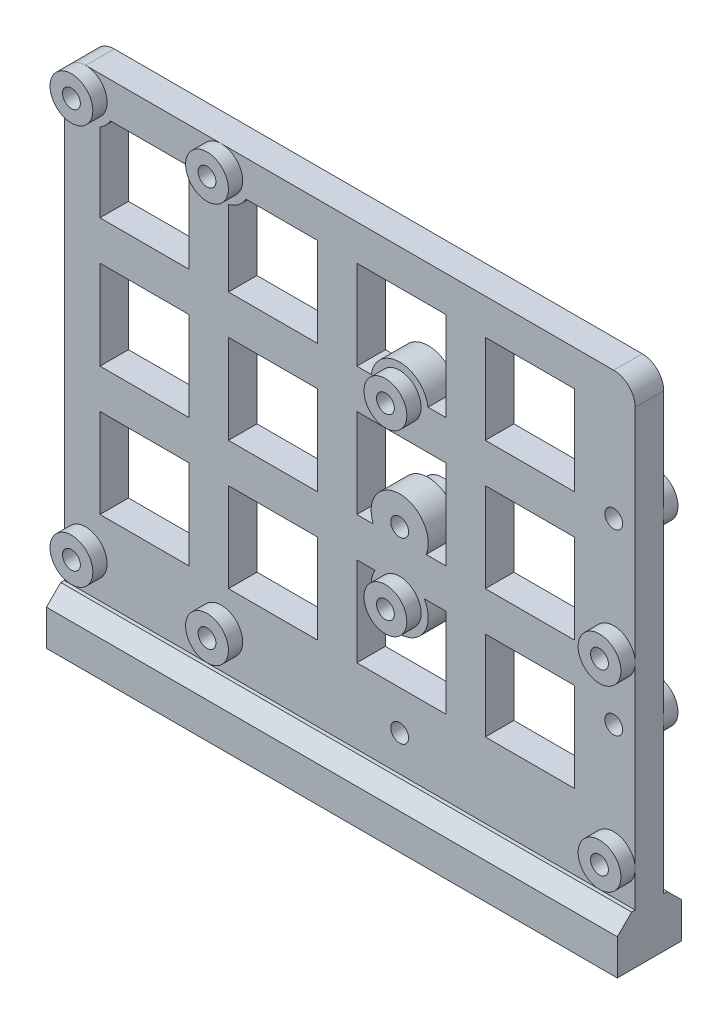
from build123d import *

# Parameters (mm, degrees)
SKETCH1_W           = 25
SKETCH1_H           = 62
SKETCH1_W_2         = 55
BOSS_EXTRUDE1_DEPTH = 4
SKETCH2_R           = 1.25
CUT_EXTRUDE1_DEPTH  = 4
BOSS_EXTRUDE2_START = 2
SKETCH3_R           = 3
SKETCH3_R_2         = 1.25
BOSS_EXTRUDE2_DEPTH = 2
SKETCH4_R           = 1.25
CUT_EXTRUDE2_DEPTH  = 10
BOSS_EXTRUDE3_START = 2
SKETCH5_R           = 3
SKETCH5_R_2         = 1.25
BOSS_EXTRUDE3_DEPTH = 2
LPATTERN1_COUNT     = 2
LPATTERN1_PITCH     = 25
SKETCH6_R           = 1.25
CUT_EXTRUDE3_DEPTH  = 75.520131508
BOSS_EXTRUDE4_START = 2
SKETCH7_R           = 3
SKETCH7_R_2         = 1.25
BOSS_EXTRUDE4_DEPTH = 2
SKETCH8_W           = 12.5
SKETCH8_H           = 12.5
CUT_EXTRUDE4_DEPTH  = 75.520131508
FILLET1_R           = 3
BOSS_EXTRUDE5_DEPTH = 2
SKETCH10_W          = 80
SKETCH10_H          = 9
BOSS_EXTRUDE6_DEPTH = 7
CHAMFER1_SIZE       = 2
SKETCH11_R          = 1.45
CUT_EXTRUDE5_DEPTH  = 7


with BuildPart() as part:
    # Sketch1 → Boss-Extrude1 (new body)
    with BuildSketch(Plane.XY):
        Rectangle(SKETCH1_W, SKETCH1_H)
        with Locations((40, 0)):
            Rectangle(SKETCH1_W_2, SKETCH1_H)
    extrude(amount=BOSS_EXTRUDE1_DEPTH)

    # Sketch2 → Cut-Extrude1 (cut)
    with BuildSketch(Plane.XY.offset(4)):
        with Locations((-9.5, -28)):
            Circle(SKETCH2_R)
        with Locations(Location((9.5, -28, 0), (0, 0, 180))):
            Circle(SKETCH2_R)
        with Locations((9.5, 28)):
            Circle(SKETCH2_R)
        with Locations(Location((-9.5, 28, 0), (0, 0, 180))):
            Circle(SKETCH2_R)
    extrude(amount=-CUT_EXTRUDE1_DEPTH, mode=Mode.SUBTRACT)

    # Sketch3 → Boss-Extrude2 (add)
    # profile 1 of 4: a face of its own
    with BuildSketch(Plane.XY.offset(4).offset(BOSS_EXTRUDE2_START)):
        with Locations(Location((-9.5, 28, 0), (0, 0, 180))):
            Circle(SKETCH3_R)
        with Locations((-9.5, 28)):
            Circle(SKETCH3_R_2, mode=Mode.SUBTRACT)
    # profile 2 of 4: a face of its own
    with BuildSketch(Plane.XY.offset(4).offset(BOSS_EXTRUDE2_START)):
        with Locations(Location((9.5, 28, 0), (0, 0, 90))):
            Circle(SKETCH3_R)
        with Locations((9.5, 28)):
            Circle(SKETCH3_R_2, mode=Mode.SUBTRACT)
    # profile 3 of 4: a face of its own
    with BuildSketch(Plane.XY.offset(4).offset(BOSS_EXTRUDE2_START)):
        with Locations(Location((-9.5, -28, 0), (0, 0, 180))):
            Circle(SKETCH3_R)
        with Locations((-9.5, -28)):
            Circle(SKETCH3_R_2, mode=Mode.SUBTRACT)
    # profile 4 of 4: a face of its own
    with BuildSketch(Plane.XY.offset(4).offset(BOSS_EXTRUDE2_START)):
        with Locations(Location((9.5, -28, 0), (0, 0, 270))):
            Circle(SKETCH3_R)
        with Locations((9.5, -28)):
            Circle(SKETCH3_R_2, mode=Mode.SUBTRACT)
    extrude(amount=-BOSS_EXTRUDE2_DEPTH)

    # Sketch4 → Cut-Extrude2 (cut)
    with BuildSketch(Plane.XY.offset(4)):
        with Locations((34.5, -12)):
            Circle(SKETCH4_R)
        with Locations((64.5, -28)):
            Circle(SKETCH4_R)
    cut_extrude2 = extrude(amount=-CUT_EXTRUDE2_DEPTH, mode=Mode.SUBTRACT)

    # Sketch5 → Boss-Extrude3 (add)
    # profile 1 of 2: a face of its own
    with BuildSketch(Plane.XY.offset(4).offset(BOSS_EXTRUDE3_START)):
        with Locations((34.5, -12)):
            Circle(SKETCH5_R)
        with Locations((34.5, -12)):
            Circle(SKETCH5_R_2, mode=Mode.SUBTRACT)
    # profile 2 of 2: a face of its own
    with BuildSketch(Plane.XY.offset(4).offset(BOSS_EXTRUDE3_START)):
        with Locations((64.5, -28)):
            Circle(SKETCH5_R)
        with Locations((64.5, -28)):
            Circle(SKETCH5_R_2, mode=Mode.SUBTRACT)
    boss_extrude3 = extrude(amount=-BOSS_EXTRUDE3_DEPTH)

    # LPattern1: Cut-Extrude2, Boss-Extrude3 ×2
    with Locations(*[(0, i * LPATTERN1_PITCH, 0) for i in range(1, LPATTERN1_COUNT)]):
        add(cut_extrude2, mode=Mode.SUBTRACT)
        add(boss_extrude3)

    # Sketch6 → Cut-Extrude3 (cut, through all)
    with BuildSketch(Plane(origin=(0, 0, 0), x_dir=(-1, 0, 0), z_dir=(0, 0, -1))):
        with Locations((-64.5, -12)):
            Circle(SKETCH6_R)
        with Locations((-34.5, -28)):
            Circle(SKETCH6_R)
        with Locations((-64.5, 13)):
            Circle(SKETCH6_R)
        with Locations((-34.5, -3)):
            Circle(SKETCH6_R)
    extrude(amount=-CUT_EXTRUDE3_DEPTH, mode=Mode.SUBTRACT)

    # Sketch7 → Boss-Extrude4 (add)
    # profile 1 of 4: a face of its own
    with BuildSketch(Plane(origin=(0, 0, 0), x_dir=(-1, 0, 0), z_dir=(0, 0, -1)).offset(BOSS_EXTRUDE4_START)):
        with Locations(Location((-64.5, 13, 0), (0, 0, 180))):
            Circle(SKETCH7_R)
        with Locations((-64.5, 13)):
            Circle(SKETCH7_R_2, mode=Mode.SUBTRACT)
    # profile 2 of 4: a face of its own
    with BuildSketch(Plane(origin=(0, 0, 0), x_dir=(-1, 0, 0), z_dir=(0, 0, -1)).offset(BOSS_EXTRUDE4_START)):
        with Locations(Location((-34.5, -3, 0), (0, 0, 180))):
            Circle(SKETCH7_R)
        with Locations((-34.5, -3)):
            Circle(SKETCH7_R_2, mode=Mode.SUBTRACT)
    # profile 3 of 4: a face of its own
    with BuildSketch(Plane(origin=(0, 0, 0), x_dir=(-1, 0, 0), z_dir=(0, 0, -1)).offset(BOSS_EXTRUDE4_START)):
        with Locations(Location((-34.5, -28, 0), (0, 0, 270))):
            Circle(SKETCH7_R)
        with Locations((-34.5, -28)):
            Circle(SKETCH7_R_2, mode=Mode.SUBTRACT)
    # profile 4 of 4: a face of its own
    with BuildSketch(Plane(origin=(0, 0, 0), x_dir=(-1, 0, 0), z_dir=(0, 0, -1)).offset(BOSS_EXTRUDE4_START)):
        with Locations(Location((-64.5, -12, 0), (0, 0, 180))):
            Circle(SKETCH7_R)
        with Locations((-64.5, -12)):
            Circle(SKETCH7_R_2, mode=Mode.SUBTRACT)
    extrude(amount=-BOSS_EXTRUDE4_DEPTH)

    # Sketch8 → Cut-Extrude4 (cut, through all)
    with BuildSketch(Plane.XY.offset(4)):
        with BuildLine():
            Line((5, 26), (-6.035898385, 26))
            ThreePointArc((-6.035898385, 26), (-6.671572875, 25.171572875), (-7.5, 24.535898385))
            Line((-7.5, 24.535898385), (-7.5, 13.5))
            Line((-7.5, 13.5), (5, 13.5))
            Line((5, 13.5), (5, 26))
        make_face()
        with BuildLine():
            ThreePointArc((12.964101615, 26), (11.920551066, 24.815516912), (10.5, 24.127016654))
            Line((10.5, 24.127016654), (10.5, 13.5))
            Line((10.5, 13.5), (23, 13.5))
            Line((23, 13.5), (23, 26))
            Line((23, 26), (12.964101615, 26))
        make_face()
        with BuildLine():
            Line((41, 26), (28.5, 26))
            Line((28.5, 26), (28.5, 13.5))
            Line((28.5, 13.5), (30.531373033, 13.5))
            ThreePointArc((30.531373033, 13.5), (34.5, 17), (38.468626967, 13.5))
            Line((38.468626967, 13.5), (41, 13.5))
            Line((41, 13.5), (41, 26))
        make_face()
        with Locations((52.75, 19.75)):
            Rectangle(SKETCH8_W, SKETCH8_H)
        with Locations((16.75, 1.75)):
            Rectangle(SKETCH8_W, SKETCH8_H)
        with BuildLine():
            Line((41, 8), (28.5, 8))
            Line((28.5, 8), (28.5, -4.5))
            Line((28.5, -4.5), (30.791900756, -4.5))
            ThreePointArc((30.791900756, -4.5), (34.5, 1), (38.208099244, -4.5))
            Line((38.208099244, -4.5), (41, -4.5))
            Line((41, -4.5), (41, 8))
        make_face()
        with Locations((52.75, 1.75)):
            Rectangle(SKETCH8_W, SKETCH8_H)
        with Locations((16.75, -16.25)):
            Rectangle(SKETCH8_W, SKETCH8_H)
        with BuildLine():
            Line((31.035898385, -10), (28.5, -10))
            Line((28.5, -10), (28.5, -22.5))
            Line((28.5, -22.5), (41, -22.5))
            Line((41, -22.5), (41, -10))
            Line((41, -10), (37.964101615, -10))
            ThreePointArc((37.964101615, -10), (34.5, -16), (31.035898385, -10))
        make_face()
        with Locations((52.75, -16.25)):
            Rectangle(SKETCH8_W, SKETCH8_H)
        with Locations((-1.25, 1.75)):
            Rectangle(SKETCH8_W, SKETCH8_H)
        with Locations((-1.25, -16.25)):
            Rectangle(SKETCH8_W, SKETCH8_H)
    extrude(amount=-CUT_EXTRUDE4_DEPTH, mode=Mode.SUBTRACT)

    # Fillet1
    fillet1_edges = [part.edges().sort_by_distance(p)[0] for p in [
        (67.5, 31, 2),
        (-12.5, 31, 2),
    ]]
    fillet(fillet1_edges, radius=FILLET1_R)

    # Sketch9 → Boss-Extrude5 (add)
    with BuildSketch(Plane.XZ.offset(31)):
        Polygon((-12.5, 0), (34.5, 0), (67.5, 0), (67.5, 4), (64.5, 4), (9.5, 4), (-9.5, 4), (-12.5, 4), align=None)
    extrude(amount=BOSS_EXTRUDE5_DEPTH)

    # Sketch10 → Boss-Extrude6 (add)
    with BuildSketch(Plane.XZ.offset(33)):
        with Locations((27.5, 2)):
            Rectangle(SKETCH10_W, SKETCH10_H)
    extrude(amount=BOSS_EXTRUDE6_DEPTH)

    # Chamfer1
    chamfer1_edges = [part.edges().sort_by_distance(p)[0] for p in [
        (27.5, -33, -2.5),
        (27.5, -33, 6.5),
    ]]
    chamfer(chamfer1_edges, length=CHAMFER1_SIZE)

    # Sketch11 → Cut-Extrude5 (cut)
    with BuildSketch(Plane.XZ.offset(40)):
        with Locations(Location((60, 2, 0), (0, 0, 270))):
            Circle(SKETCH11_R)
        with Locations(Location((-5, 2, 0), (0, 0, 90))):
            Circle(SKETCH11_R)
    extrude(amount=-CUT_EXTRUDE5_DEPTH, mode=Mode.SUBTRACT)


solid = part.part
